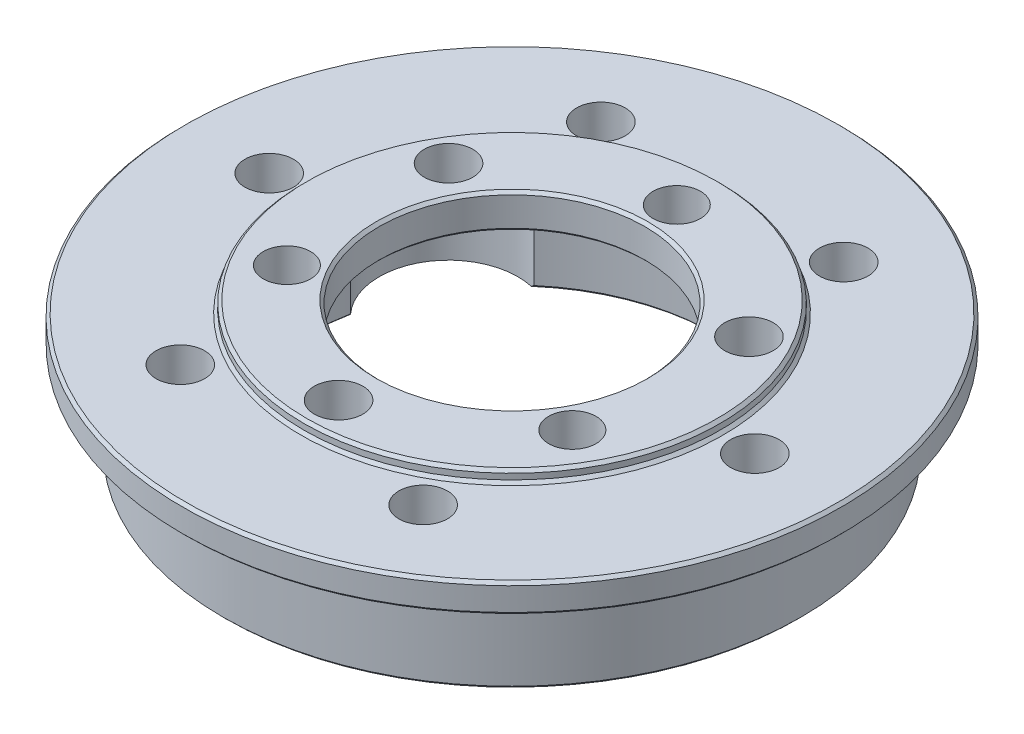
from build123d import *

# Parameters (mm, degrees)
CHAMFER_1_SIZE           = 0.25
SKETCH_2_R               = 2.1
SKETCH_2_R_2             = 2.05
CUT_EXTRUDE_1_DEPTH      = 42.191625362
SKETCH_3_R               = 6
CUT_EXTRUDE_2_DEPTH      = 42.191625362
PATTERN_CIRCULAR_1_COUNT = 3
SKETCH_4_R               = 2.1
CUT_EXTRUDE_3_DEPTH      = 42.913601611
PATTERN_CIRCULAR_2_COUNT = 6


with BuildPart() as part:
    # 草图1 → 旋转1 (revolve)
    with BuildSketch(Plane.XY, mode=Mode.PRIVATE) as revolve_1_sk:
        Polygon((-25, 0), (-17.5, 0), (-17.5, 8.5), (-11.5, 8.5), (-11.5, 11.5), (-18, 11.5), (-18, 10.5), (-28.5, 10.5), (-28.5, 8), (-25, 8), align=None)
    revolve(revolve_1_sk.sketch.rotate(Axis((0, 0, 0), (0, 1, 0)), 270), axis=Axis((0, 0, 0), (0, 1, 0)))

    # 倒角1
    chamfer_1_edges = [part.edges().sort_by_distance(p)[0] for p in [
        (0, 11.5, 11.5),
        (0, 8.5, 11.5),
        (0, 8.5, 17.5),
        (0, 0, 17.5),
        (0, 0, 25),
        (0, 8, 25),
        (0, 8, 28.5),
        (0, 10.5, 28.5),
        (0, 10.5, 18),
        (0, 11.5, 18),
    ]]
    chamfer(chamfer_1_edges, length=CHAMFER_1_SIZE)

    # 草图2 → 切除-拉伸1 (cut, through all)
    with BuildSketch(Plane.XZ.offset(-8.5)):
        with Locations(Location((0, 15, 0), (0, 0, 270))):
            Circle(SKETCH_2_R)
        with Locations(Location((0, -14.25, 0), (0, 0, 270))):
            Circle(SKETCH_2_R_2)
    cut_extrude_1 = extrude(amount=-CUT_EXTRUDE_1_DEPTH, mode=Mode.SUBTRACT)

    # 草图3 → 切除-拉伸2 (cut, through all)
    with BuildSketch(Plane.XZ.offset(-8.5)):
        with Locations((0, 15)):
            Circle(SKETCH_3_R)
    cut_extrude_2 = extrude(amount=CUT_EXTRUDE_2_DEPTH, mode=Mode.SUBTRACT)

    # 阵列(圆周)1: 切除-拉伸1, 切除-拉伸2 ×3 about axis
    pattern_circular_1_axis = Axis((0, 0, 0), (0, 1, 0))
    add([cut_extrude_1.rotate(pattern_circular_1_axis, i * 360 / PATTERN_CIRCULAR_1_COUNT) for i in range(1, PATTERN_CIRCULAR_1_COUNT)], mode=Mode.SUBTRACT)
    add([cut_extrude_2.rotate(pattern_circular_1_axis, i * 360 / PATTERN_CIRCULAR_1_COUNT) for i in range(1, PATTERN_CIRCULAR_1_COUNT)], mode=Mode.SUBTRACT)

    # 草图4 → 切除-拉伸3 (cut, through all)
    with BuildSketch(Plane.XZ):
        with Locations(Location((10.5, 18.186533479, 0), (0, 0, 270))):
            Circle(SKETCH_4_R)
    cut_extrude_3 = extrude(amount=-CUT_EXTRUDE_3_DEPTH, mode=Mode.SUBTRACT)

    # 阵列(圆周)2: 切除-拉伸3 ×6 about axis
    pattern_circular_2_axis = Axis((0, 0, 0), (0, 1, 0))
    for i in range(1, PATTERN_CIRCULAR_2_COUNT):
        add(cut_extrude_3.rotate(pattern_circular_2_axis, i * 360 / PATTERN_CIRCULAR_2_COUNT), mode=Mode.SUBTRACT)


solid = part.part
